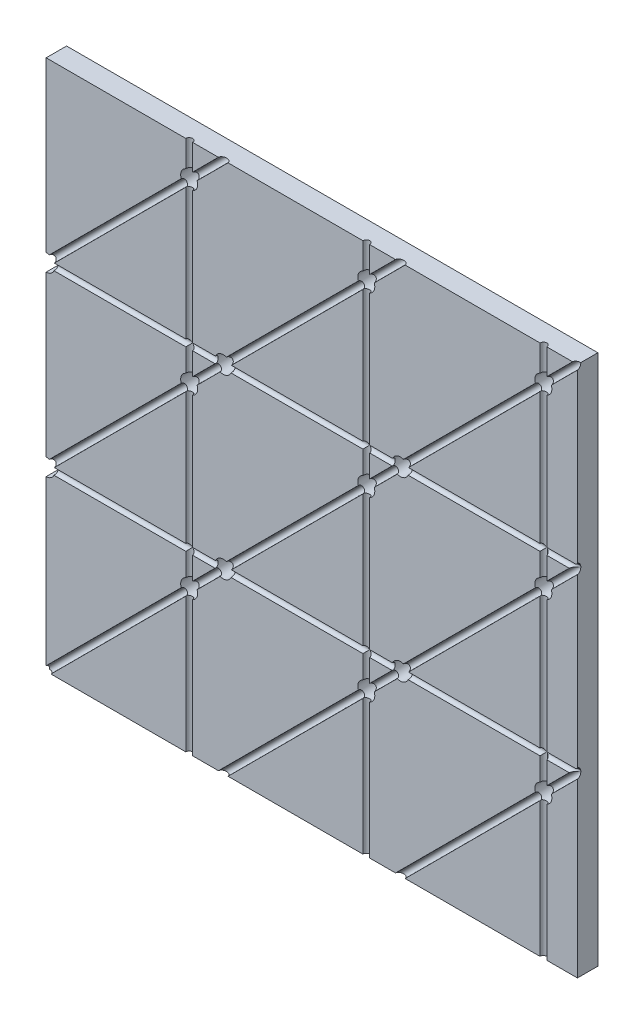
from build123d import *

# Parameters (mm, degrees)
SKETCH1_W           = 156
SKETCH1_H           = 156
BOSS_EXTRUDE1_DEPTH = 6
SKETCH4_R           = 1
CUT_EXTRUDE2_DEPTH  = 221.698889893
SKETCH6_R           = 1
CUT_EXTRUDE3_DEPTH  = 247.730622339
SKETCH7_R           = 1
CUT_EXTRUDE4_DEPTH  = 221.698890105
SKETCH8_R           = 2.5
CUT_EXTRUDE5_DEPTH  = 221.698890105


with BuildPart() as part:
    # Sketch1 → Boss-Extrude1 (new body)
    with BuildSketch(Plane.XY):
        with Locations((78, -78)):
            Rectangle(SKETCH1_W, SKETCH1_H)
    extrude(amount=BOSS_EXTRUDE1_DEPTH)

    # Sketch4 → Cut-Extrude2 (cut, through all)
    with BuildSketch(Plane.ZY):
        with Locations((6, -52)):
            Circle(SKETCH4_R)
        with Locations((6, -104)):
            Circle(SKETCH4_R)
    extrude(amount=-CUT_EXTRUDE2_DEPTH, mode=Mode.SUBTRACT)

    # Sketch6 → Cut-Extrude3 (cut, through all)
    with BuildSketch(Plane(origin=(-78, -78, 0), x_dir=(0.7071067811865475, -0.7071067811865477, 0), z_dir=(0.7071067811865477, 0.7071067811865475, 0))):
        with Locations((73.539105243, -6)):
            Circle(SKETCH6_R)
        with Locations((36.769552622, -6)):
            Circle(SKETCH6_R)
        with Locations((110.308657865, -6)):
            Circle(SKETCH6_R)
        with Locations((147.078210487, -6)):
            Circle(SKETCH6_R)
        with Locations((183.847763109, -6)):
            Circle(SKETCH6_R)
    extrude(amount=CUT_EXTRUDE3_DEPTH, mode=Mode.SUBTRACT)

    # Sketch7 → Cut-Extrude4 (cut, through all)
    with BuildSketch(Plane.XZ.offset(156)):
        with Locations((42, 6)):
            Circle(SKETCH7_R)
        with Locations((94, 6)):
            Circle(SKETCH7_R)
        with Locations((146, 6)):
            Circle(SKETCH7_R)
    extrude(amount=-CUT_EXTRUDE4_DEPTH, mode=Mode.SUBTRACT)

    # Sketch8 → Cut-Extrude5 (cut, through all)
    with BuildSketch(Plane.XY.offset(6)):
        with Locations((42, -10)):
            Circle(SKETCH8_R)
        with Locations((52, -52)):
            Circle(SKETCH8_R)
        with Locations((42, -62)):
            Circle(SKETCH8_R)
        with Locations((94, -62)):
            Circle(SKETCH8_R)
        with Locations((104, -52)):
            Circle(SKETCH8_R)
        with Locations((104, -104)):
            Circle(SKETCH8_R)
        with Locations((94, -114)):
            Circle(SKETCH8_R)
        with Locations((42, -114)):
            Circle(SKETCH8_R)
        with Locations((52, -104)):
            Circle(SKETCH8_R)
        with Locations((146, -62)):
            Circle(SKETCH8_R)
        with Locations((146, -10)):
            Circle(SKETCH8_R)
        with Locations((94, -10)):
            Circle(SKETCH8_R)
        with Locations((146, -114)):
            Circle(SKETCH8_R)
        with Locations((0, -52)):
            Circle(SKETCH8_R)
        with Locations((0, -104)):
            Circle(SKETCH8_R)
    extrude(amount=-CUT_EXTRUDE5_DEPTH, mode=Mode.SUBTRACT)


solid = part.part
